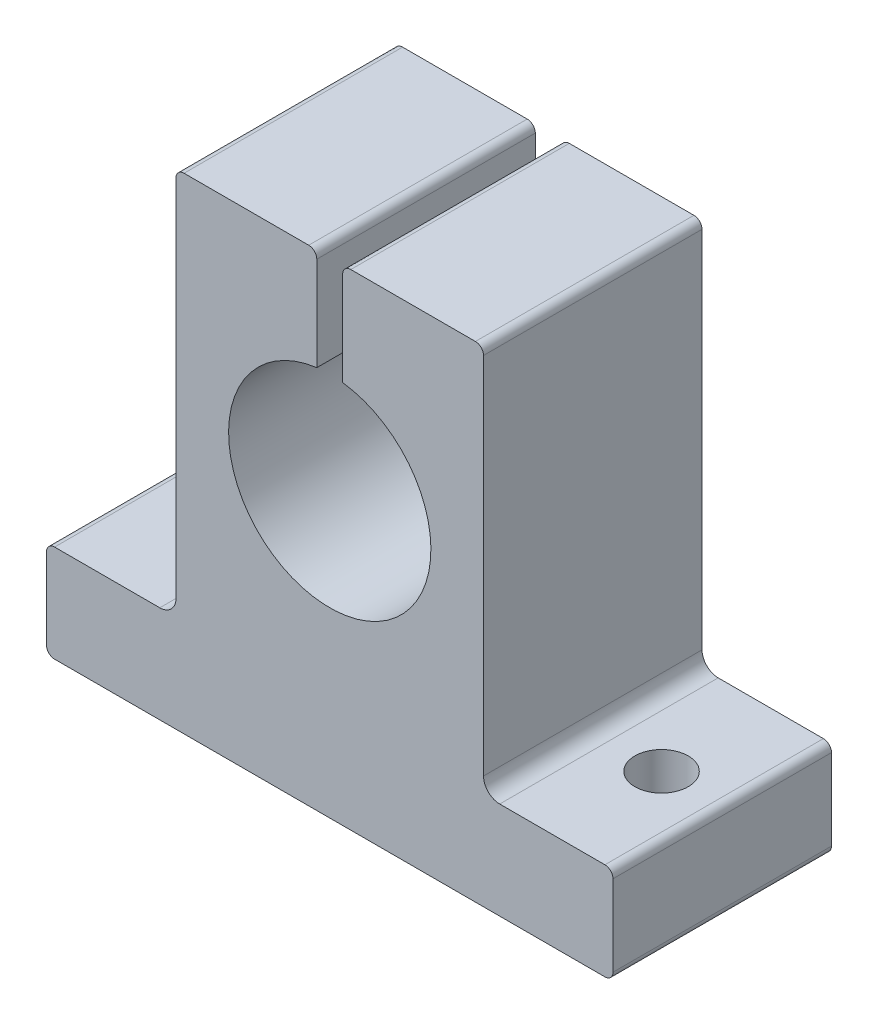
from build123d import *

# Parameters (mm, degrees)
BOSS_EXTRUDE1_DEPTH = 27
SKETCH2_R           = 3.3
CUT_EXTRUDE1_DEPTH  = 66.253352404


with BuildPart() as part:
    # Sketch1 → Boss-Extrude1 (new body)
    with BuildSketch(Plane.XY):
        with BuildLine():
            Line((-35, -34), (-35, -24))
            ThreePointArc((-35, -24), (-34.707106781, -23.292893219), (-34, -23))
            Line((-34, -23), (-21, -23))
            ThreePointArc((-21, -23), (-19.585786438, -22.414213562), (-19, -21))
            Line((-19, -21), (-19, 24))
            ThreePointArc((-19, 24), (-18.707106781, 24.707106781), (-18, 25))
            Line((-18, 25), (-2.6, 25))
            ThreePointArc((-2.6, 25), (-1.892893219, 24.707106781), (-1.6, 24))
            Line((-1.6, 24), (-1.6, 12.397177098))
            ThreePointArc((-1.6, 12.397177098), (0, -12.5), (1.6, 12.397177098))
            Line((1.6, 12.397177098), (1.6, 24))
            ThreePointArc((1.6, 24), (1.892893219, 24.707106781), (2.6, 25))
            Line((2.6, 25), (18, 25))
            ThreePointArc((18, 25), (18.707106781, 24.707106781), (19, 24))
            Line((19, 24), (19, -21))
            ThreePointArc((19, -21), (19.585786438, -22.414213562), (21, -23))
            Line((21, -23), (34, -23))
            ThreePointArc((34, -23), (34.707106781, -23.292893219), (35, -24))
            Line((35, -24), (35, -34))
            ThreePointArc((35, -34), (34.707106781, -34.707106781), (34, -35))
            Line((34, -35), (-34, -35))
            ThreePointArc((-34, -35), (-34.707106781, -34.707106781), (-35, -34))
        make_face()
    extrude(amount=BOSS_EXTRUDE1_DEPTH)

    # Sketch2 → Cut-Extrude1 (cut, through all)
    with BuildSketch(Plane(origin=(0, -23, 0), x_dir=(1, 0, 0), z_dir=(0, 1, 0))):
        with Locations(Location((-27.5, -13.5, 0), (0, 0, 270))):
            Circle(SKETCH2_R)
    cut_extrude1 = extrude(amount=-CUT_EXTRUDE1_DEPTH, mode=Mode.SUBTRACT)

    # Mirror1: Cut-Extrude1 across plane
    add(cut_extrude1.mirror(Plane(origin=(0, 0, 0), x_dir=(0, 0, 1), z_dir=(1, 0, 0))), mode=Mode.SUBTRACT)


solid = part.part
